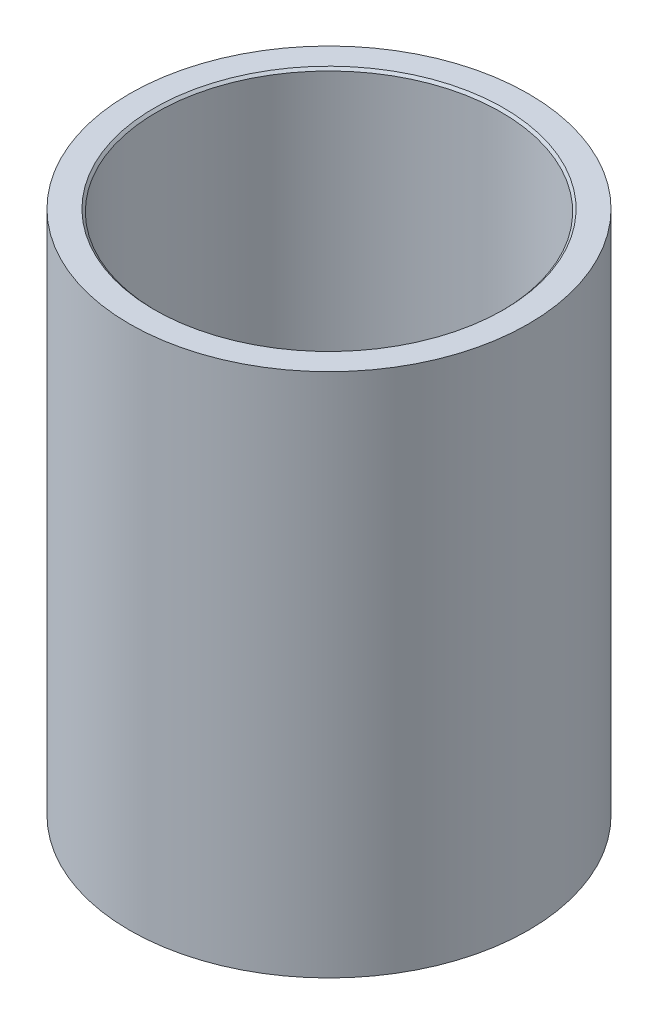
from build123d import *

# Parameters (mm, degrees)
FILLET3_R     = 4
CHAMFER1_SIZE = 0.3569


with BuildPart() as part:
    # Main Revolve Sketch → Cylinder Main Revolve (revolve)
    with BuildSketch(Plane.XY, mode=Mode.PRIVATE) as cylinder_main_revolve_sk:
        Polygon((0, 0), (29.4, 0), (29.4, 77.4), (25.4, 77.4), (25.4, 4), (0, 4), align=None)
    revolve(cylinder_main_revolve_sk.sketch.rotate(Axis((0, 4, 0), (0, -1, 0)), 180), axis=Axis((0, 4, 0), (0, -1, 0)))

    # Fillet3
    fillet3_edges = [part.edges().sort_by_distance(p)[0] for p in [
        (25.4, 4, 0),
    ]]
    fillet(fillet3_edges, radius=FILLET3_R)

    # Chamfer1
    chamfer1_edges = [part.edges().sort_by_distance(p)[0] for p in [
        (25.4, 77.4, 0),
    ]]
    chamfer(chamfer1_edges, length=CHAMFER1_SIZE)


solid = part.part
